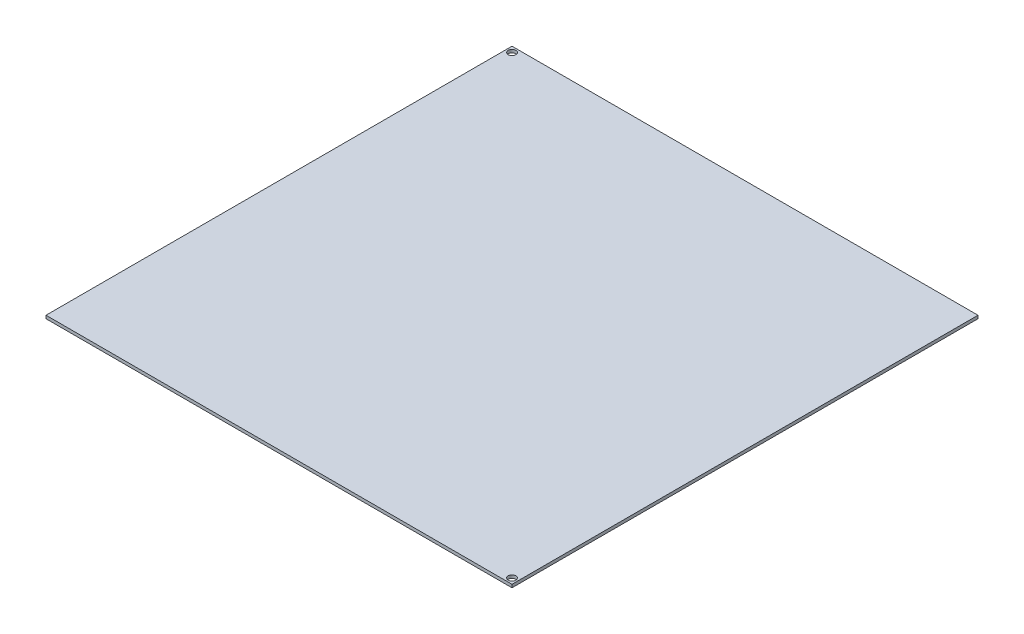
from build123d import *

# Parameters (mm, degrees)
SKETCH1_W           = 213
SKETCH1_H           = 213
BOSS_EXTRUDE1_DEPTH = 1.4
SKETCH2_R           = 1.75
CUT_EXTRUDE1_DEPTH  = 302.230742123


with BuildPart() as part:
    # Sketch1 → Boss-Extrude1 (new body)
    with BuildSketch(Plane(origin=(0, 0, 0), x_dir=(1, 0, 0), z_dir=(0, 1, 0))):
        with Locations((106.5, 106.5)):
            Rectangle(SKETCH1_W, SKETCH1_H)
    extrude(amount=BOSS_EXTRUDE1_DEPTH)

    # Sketch2 → Cut-Extrude1 (cut, through all)
    with BuildSketch(Plane(origin=(0, 1.4, 0), x_dir=(1, 0, 0), z_dir=(0, 1, 0))):
        with Locations(Location((2.499622471, 210.500377529, 0), (0, 0, 270))):
            Circle(SKETCH2_R)
        with Locations(Location((210.502153225, 2.497846775, 0), (0, 0, 270))):
            Circle(SKETCH2_R)
    extrude(amount=-CUT_EXTRUDE1_DEPTH, mode=Mode.SUBTRACT)


solid = part.part
